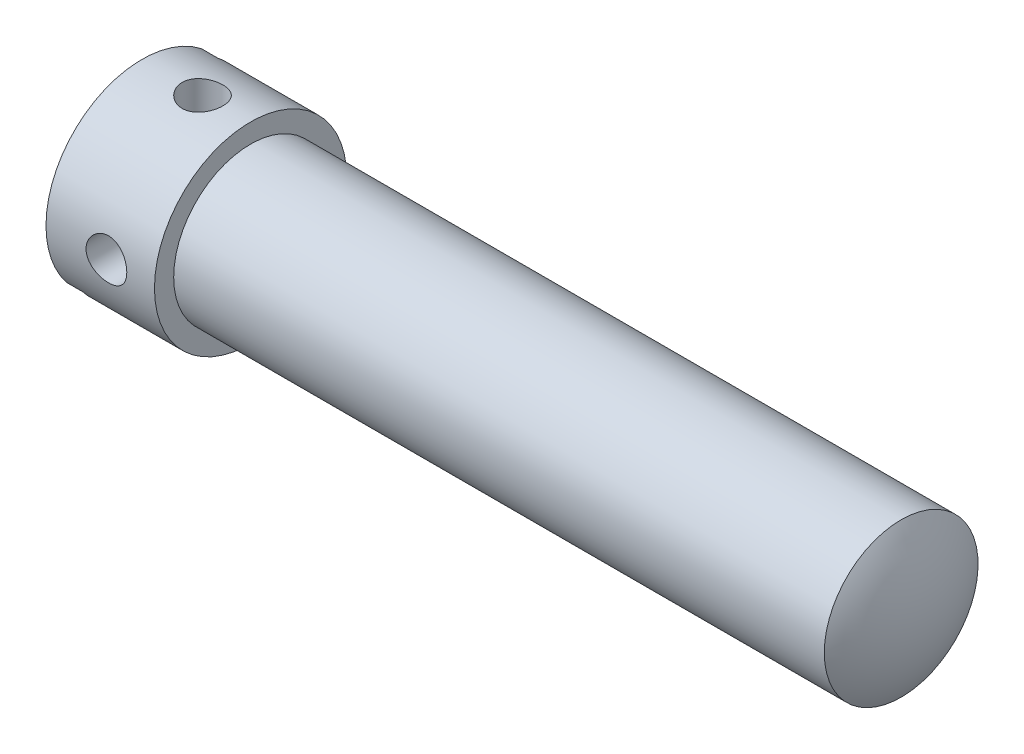
from build123d import *

# Parameters (mm, degrees)
SKETCH2_R          = 4
NECK_DEPTH         = 35
SKETCH5_R          = 1.06
CUT_EXTRUDE1_DEPTH = 70
SKETCH6_R          = 1.06
CUT_EXTRUDE2_DEPTH = 70
SKETCH7_W          = 1.7
SKETCH7_H          = 1.2
CUT_EXTRUDE3_DEPTH = 70
SCALE_1_SCALE      = 1.5


with BuildPart() as part:
    # Sketch1 → BaseHead (revolve)
    with BuildSketch(Plane.XY):
        with BuildLine():
            Line((0.857864376, 5), (6.5, 5))
            Line((6.5, 5), (6.5, 0))
            Line((6.5, 0), (0, 0))
            ThreePointArc((0, 0), (0.216021605, 2.536529681), (0.857864376, 5))
        make_face()
    revolve(axis=Axis((-25.059543495, 0, 0), (1, 0, 0)))

    # Sketch2 → Neck (add)
    with BuildSketch(Plane(origin=(6.5, 3.614329884, 0.195577912), x_dir=(0, 0, -1), z_dir=(1, 0, 0))):
        with Locations(Location((0.195577912, -3.614329884, 0), (0, 0, 180))):
            Circle(SKETCH2_R)
    extrude(amount=NECK_DEPTH)

    # Sketch4 → Cut-Revolve1 (revolve, cut)
    with BuildSketch(Plane.XY, mode=Mode.PRIVATE) as cut_revolve1_sk:
        with BuildLine():
            Line((34, 7.5), (34, 12.5))
            Line((34, 12.5), (46.5, 12.5))
            Line((46.5, 12.5), (46.5, 0))
            Line((46.5, 0), (41.5, 0))
            ThreePointArc((41.5, 0), (39.303300859, 5.303300859), (34, 7.5))
        make_face()
    revolve(cut_revolve1_sk.sketch.rotate(Axis((61.414233577, 0, 0), (-1, 0, 0)), 270), axis=Axis((61.414233577, 0, 0), (-1, 0, 0)), mode=Mode.SUBTRACT)

    # Sketch5 → Cut-Extrude1 (cut, symmetric)
    with BuildSketch(Plane.XY):
        with Locations((4, 0)):
            Circle(SKETCH5_R)
    extrude(amount=CUT_EXTRUDE1_DEPTH, both=True, mode=Mode.SUBTRACT)

    # Sketch6 → Cut-Extrude2 (cut, symmetric)
    with BuildSketch(Plane(origin=(0, 0, 0), x_dir=(1, 0, 0), z_dir=(0, 1, 0))):
        with Locations(Location((4, 0, 0), (0, 0, 270))):
            Circle(SKETCH6_R)
    extrude(amount=CUT_EXTRUDE2_DEPTH, both=True, mode=Mode.SUBTRACT)

    # Sketch7 → Cut-Extrude3 (cut, symmetric)
    with BuildSketch(Plane(origin=(0, 0, 0), x_dir=(1, 0, 0), z_dir=(0, -0.7071067811865488, 0.7071067811865462))):
        with Locations((0.85, 0)):
            Rectangle(SKETCH7_W, SKETCH7_H)
    extrude(amount=CUT_EXTRUDE3_DEPTH, both=True, mode=Mode.SUBTRACT)


with BuildPart() as part_1:
    # 缩放比例1: scaled about (19.948892128, -3.087e-06, -4.178e-06)
    add(part.part.scale(SCALE_1_SCALE).moved(Location((-9.974446064, 1.543e-06, 2.089e-06))))


solid = part_1.part
